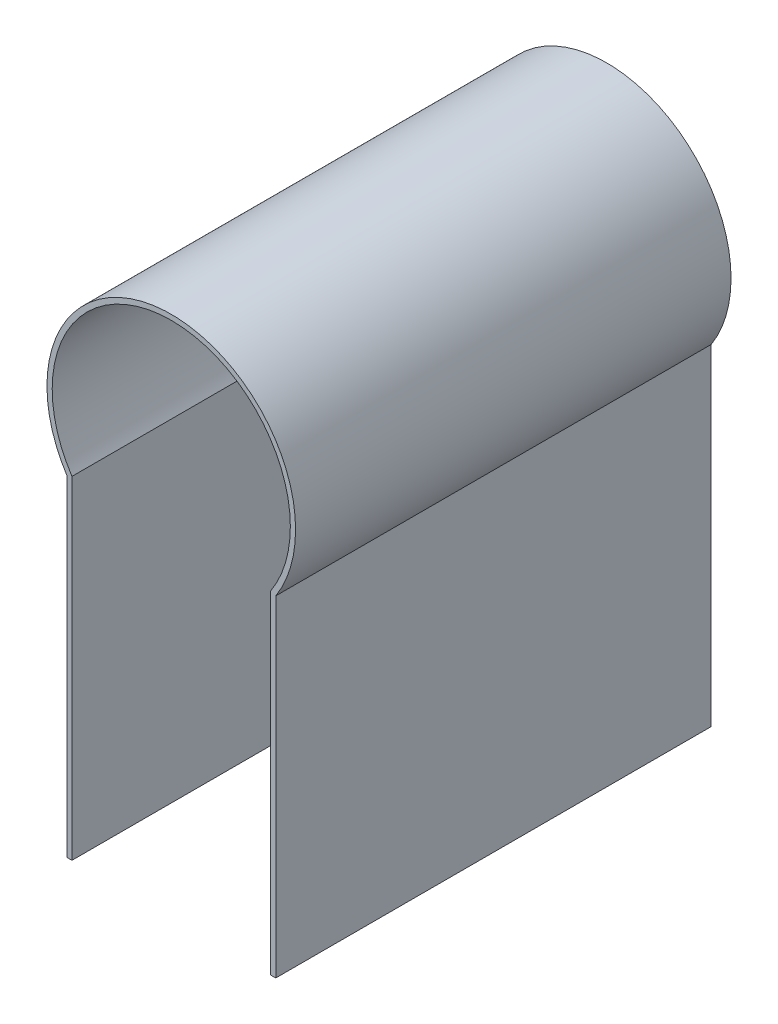
from build123d import *

# Parameters (mm, degrees)
SALIENTE_EXTRUIR1_DEPTH = 250


with BuildPart() as part:
    # Croquis1 → Saliente-Extruir1 (new body)
    with BuildSketch(Plane.XY):
        with BuildLine():
            Line((60, 0), (60, 190))
            ThreePointArc((60, 190), (0, 300), (-60, 190))
            Line((-60, 190), (-60, 0))
            Line((-60, 0), (-57, 0))
            Line((-57, 0), (-57, 190.892665131))
            ThreePointArc((-57, 190.892665131), (0, 297), (57, 190.892665131))
            Line((57, 190.892665131), (57, 0))
            Line((57, 0), (60, 0))
        make_face()
    extrude(amount=SALIENTE_EXTRUIR1_DEPTH)


solid = part.part
